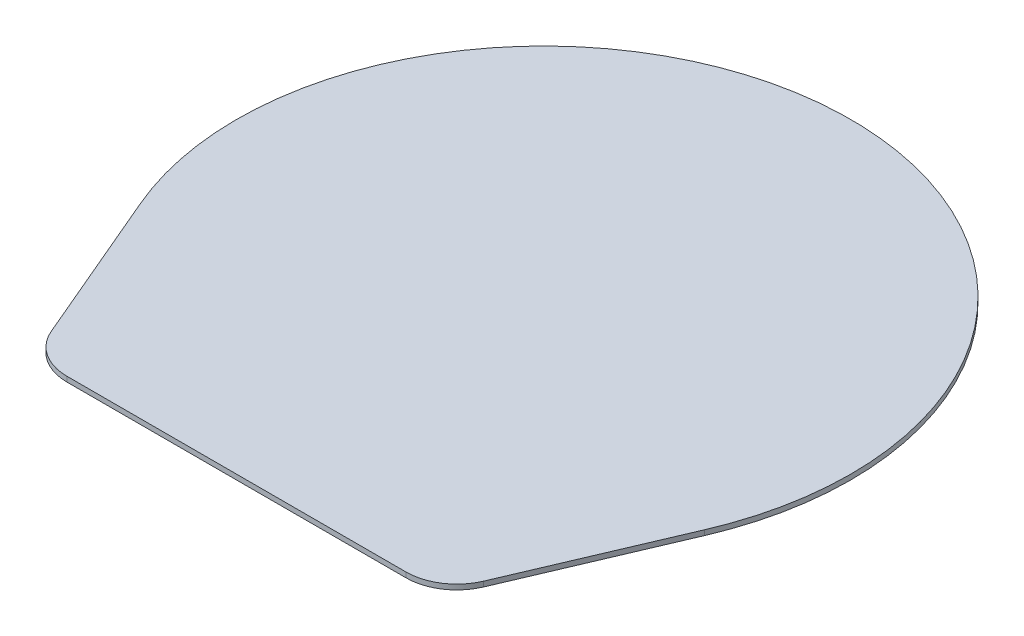
from build123d import *

# Parameters (mm, degrees)
SKETCH1_R           = 60.5
BOSS_EXTRUDE1_DEPTH = 1
BOSS_EXTRUDE2_START = -1
BOSS_EXTRUDE2_DEPTH = 1
FILLET1_R           = 10


with BuildPart() as part:
    # Sketch1 → Boss-Extrude1 (new body)
    with BuildSketch(Plane(origin=(0, 0, 0), x_dir=(1, 0, 0), z_dir=(0, 1, 0))):
        with Locations(Location((0, 0, 0), (0, 0, 270))):
            Circle(SKETCH1_R)
    extrude(amount=BOSS_EXTRUDE1_DEPTH)

    # Sketch7 → Boss-Extrude2 (add)
    with BuildSketch(Plane(origin=(0, 1, 0), x_dir=(1, 0, 0), z_dir=(0, 1, 0)).offset(BOSS_EXTRUDE2_START)):
        with BuildLine():
            Line((-55.577310907, -23.904236284), (-40, -60.5))
            Line((-40, -60.5), (2.22e-07, -60.5))
            ThreePointArc((2.22e-07, -60.5), (-33.271937819, -50.529478067), (-55.577310907, -23.904236284))
        make_face()
        with BuildLine():
            ThreePointArc((55.577310907, -23.904236284), (33.271938005, -50.529477945), (2.22e-07, -60.5))
            Line((2.22e-07, -60.5), (40, -60.5))
            Line((40, -60.5), (55.577310907, -23.904236284))
        make_face()
    extrude(amount=BOSS_EXTRUDE2_DEPTH)

    # Fillet1
    fillet1_edges = [part.edges().sort_by_distance(p)[0] for p in [
        (40, 0.5, 60.5),
        (-40, 0.5, 60.5),
    ]]
    fillet(fillet1_edges, radius=FILLET1_R)


solid = part.part
